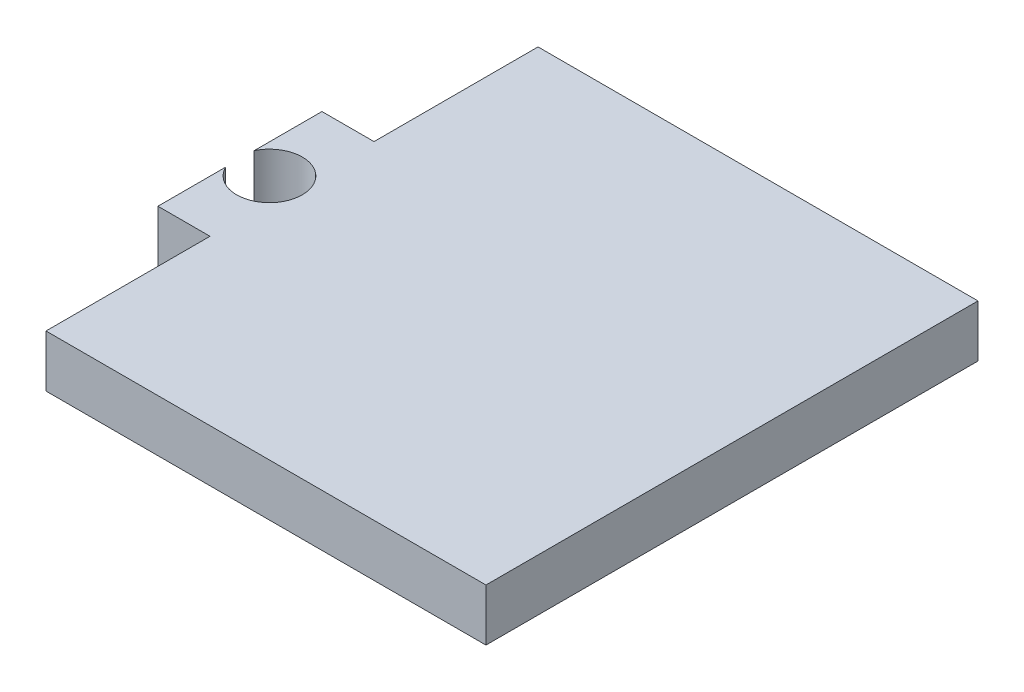
from build123d import *

# Parameters (mm, degrees)
BOSS_EXTRUDE1_DEPTH = 3.175


with BuildPart() as part:
    # Sketch1 → Boss-Extrude1 (new body)
    with BuildSketch(Plane(origin=(0, 0, 0), x_dir=(1, 0, 0), z_dir=(0, 1, 0))):
        with BuildLine():
            Line((0, 15.871779789), (0, 20))
            Line((0, 20), (3.175, 20))
            Line((3.175, 20), (3.175, 30))
            Line((3.175, 30), (30, 30))
            Line((30, 30), (30, 0))
            Line((30, 0), (3.175, 0))
            Line((3.175, 0), (3.175, 10))
            Line((3.175, 10), (0, 10))
            Line((0, 10), (0, 14.128220211))
            ThreePointArc((0, 14.128220211), (3.8, 15), (0, 15.871779789))
        make_face()
    extrude(amount=BOSS_EXTRUDE1_DEPTH)


solid = part.part
